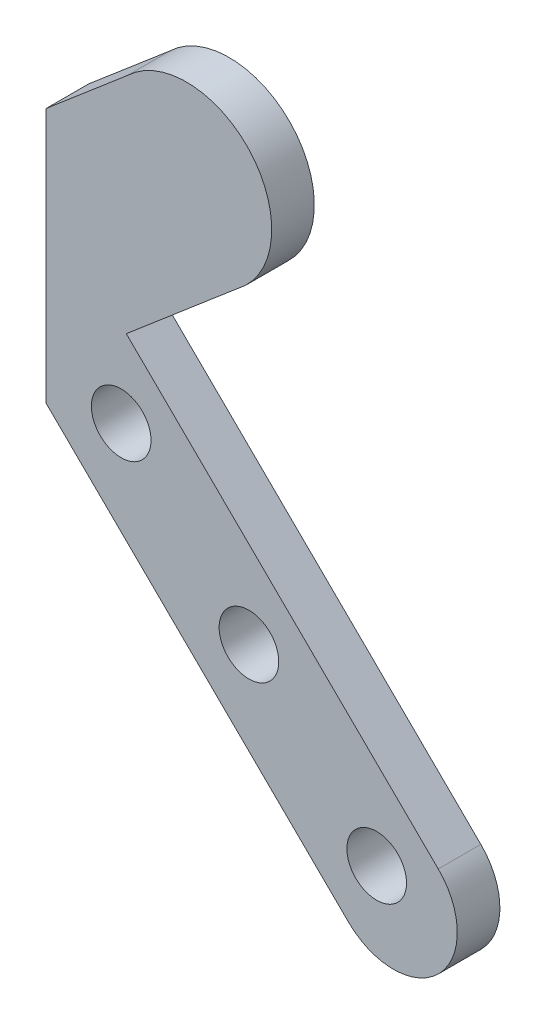
from build123d import *

# Parameters (mm, degrees)
BOSS_EXTRUDE1_DEPTH = 10
SKETCH2_R           = 7
CUT_EXTRUDE1_DEPTH  = 197.513344998


with BuildPart() as part:
    # Sketch1 → Boss-Extrude1 (new body)
    with BuildSketch(Plane.XY):
        with BuildLine():
            Line((5.549773739, -33.303117211), (5.549773739, -93.303117211))
            Line((5.549773739, -93.303117211), (76.549773739, -163.303117211))
            ThreePointArc((76.549773739, -163.303117211), (97.76244369, -163.152672743), (97.611999223, -141.940002792))
            Line((97.611999223, -141.940002792), (24.355880913, -69.715660797))
            Line((24.355880913, -69.715660797), (52.420485151, -45.825449879))
            ThreePointArc((52.420485151, -45.825449879), (52.86718031, -17.544706193), (24.586436624, -17.098011034))
            Line((24.586436624, -17.098011034), (5.549773739, -33.303117211))
        make_face()
    extrude(amount=BOSS_EXTRUDE1_DEPTH)

    # Sketch2 → Cut-Extrude1 (cut, through all)
    with BuildSketch(Plane.XY.offset(10)):
        with Locations((23.151883869, -88.542112922)):
            Circle(SKETCH2_R)
        with Locations((53.151883869, -118.542112922)):
            Circle(SKETCH2_R)
        with Locations((83.151883869, -148.542112922)):
            Circle(SKETCH2_R)
    extrude(amount=-CUT_EXTRUDE1_DEPTH, mode=Mode.SUBTRACT)


solid = part.part
